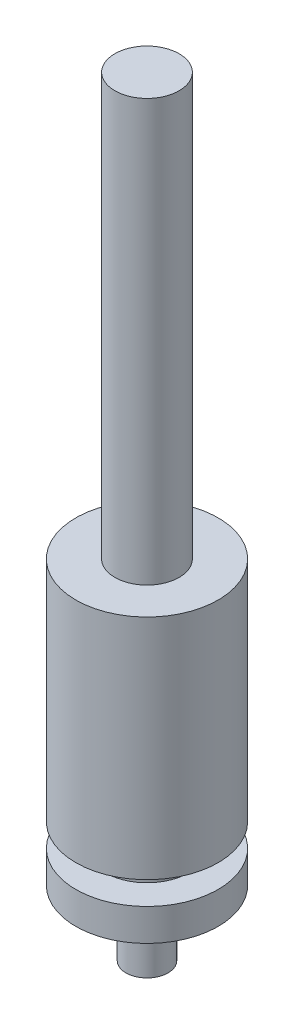
from build123d import *

# Parameters (mm, degrees)
SKETCH1_R           = 16.891
EXTRUDE1_DEPTH      = 7.6
SKETCH2_R           = 9.998276061
EXTRUDE2_DEPTH      = 5.5
SKETCH3_R           = 16.891
EXTRUDE3_DEPTH      = 53.975
SKETCH4_R           = 5.5
BOSS_EXTRUDE1_DEPTH = 15.5
CUT_EXTRUDE1_START  = -9
SKETCH5_R           = 5.5
SKETCH5_R_2         = 5
CUT_EXTRUDE1_DEPTH  = 9
SKETCH6_R           = 7.62
BOSS_EXTRUDE2_DEPTH = 100


with BuildPart() as part:
    # Sketch1 → Extrude1 (new body)
    with BuildSketch(Plane(origin=(0, 0, 0), x_dir=(1, 0, 0), z_dir=(0, 1, 0))):
        with Locations(Location((0, 0, 0), (0, 0, 90))):
            Circle(SKETCH1_R)
    extrude(amount=EXTRUDE1_DEPTH)

    # Sketch2 → Extrude2 (add)
    with BuildSketch(Plane(origin=(0, 7.6, 0), x_dir=(1, 0, 0), z_dir=(0, 1, 0))):
        with Locations(Location((0, 0, 0), (0, 0, 270))):
            Circle(SKETCH2_R)
    extrude(amount=EXTRUDE2_DEPTH)

    # Sketch3 → Extrude3 (add)
    with BuildSketch(Plane(origin=(0, 13.1, 0), x_dir=(1, 0, 0), z_dir=(0, 1, 0))):
        with Locations(Location((0, 0, 0), (0, 0, 90))):
            Circle(SKETCH3_R)
    extrude(amount=EXTRUDE3_DEPTH)

    # Sketch4 → Boss-Extrude1 (add)
    with BuildSketch(Plane.XZ):
        with Locations(Location((0, 0, 0), (0, 0, 90))):
            Circle(SKETCH4_R)
    extrude(amount=BOSS_EXTRUDE1_DEPTH)

    # Sketch5 → Cut-Extrude1 (cut)
    with BuildSketch(Plane.XZ.offset(15.5).offset(CUT_EXTRUDE1_START)):
        with Locations(Location((0, 0, 0), (0, 0, 90))):
            Circle(SKETCH5_R)
        with Locations(Location((0, 0, 0), (0, 0, 270))):
            Circle(SKETCH5_R_2, mode=Mode.SUBTRACT)
    extrude(amount=CUT_EXTRUDE1_DEPTH, mode=Mode.SUBTRACT)

    # Sketch6 → Boss-Extrude2 (add)
    with BuildSketch(Plane(origin=(0, 67.075, 0), x_dir=(-1, 0, 0), z_dir=(0, 1, 0))):
        with Locations(Location((0, 0, 0), (0, 0, 90))):
            Circle(SKETCH6_R)
    extrude(amount=BOSS_EXTRUDE2_DEPTH)


solid = part.part
